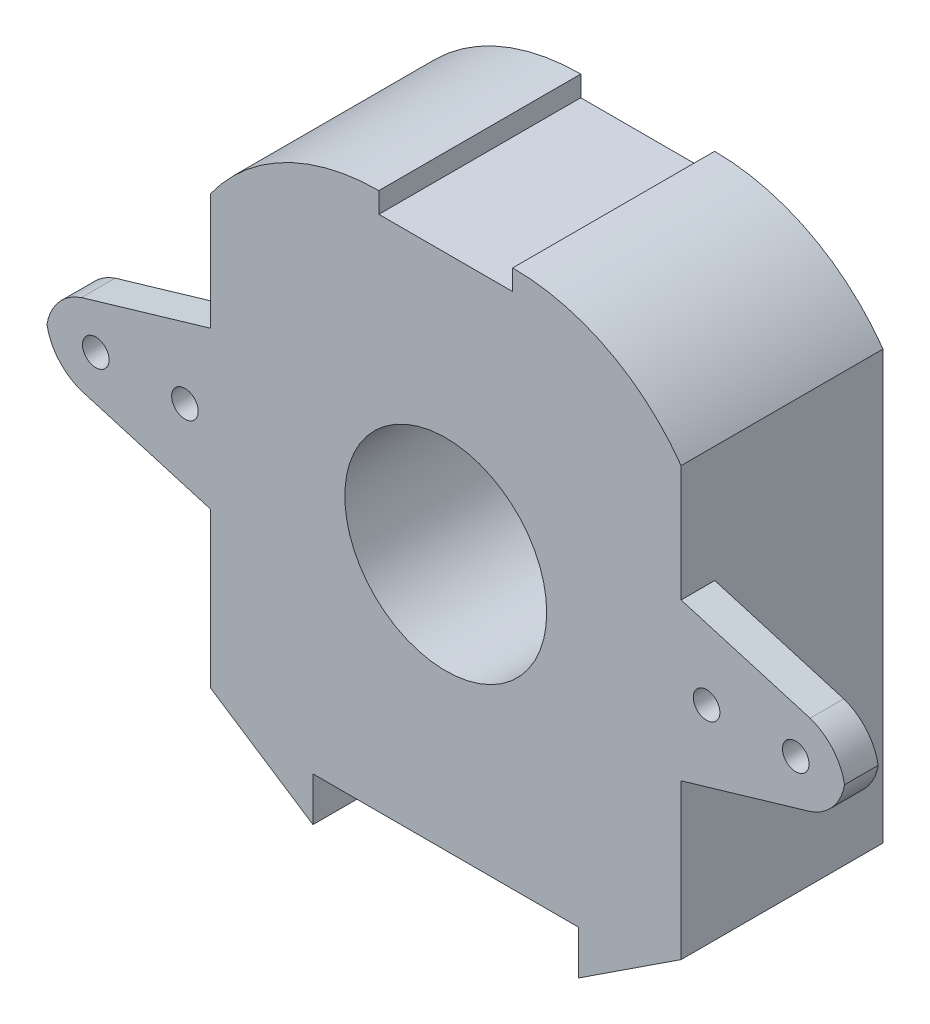
from build123d import *

# Parameters (mm, degrees)
BOSS_EXTRUDE2_DEPTH     = 15.24
SKETCH5_R               = 7.62
CUT_EXTRUDE2_DEPTH      = 15.24
BOSS_EXTRUDE3_DEPTH     = 2.54
CUT_EXTRUDE5_DEPTH      = 41.652633663
CUT_EXTRUDE5_DEPTH_BACK = 41.652633663
SKETCH7_R               = 1.0033


with BuildPart() as part:
    # Sketch1 → Boss-Extrude2 (new body)
    with BuildSketch(Plane.XY):
        with BuildLine():
            Line((-17.763499893, 14.683044609), (-17.763499893, -17.608986031))
            Line((-17.763499893, -17.608986031), (-10.024087591, -22.679635471))
            Line((-10.024087591, -22.679635471), (-10.024087591, -19.359490178))
            Line((-10.024087591, -19.359490178), (10.024087591, -19.359490178))
            Line((10.024087591, -19.359490178), (10.024087591, -22.679635471))
            Line((10.024087591, -22.679635471), (17.763499893, -17.608986031))
            Line((17.763499893, -17.608986031), (17.763499893, 14.683044609))
            ThreePointArc((17.763499893, 14.683044609), (12.2054587, 19.511759091), (5.051122326, 21.250660037))
            Line((5.051122326, 21.250660037), (5.051122326, 19.699745061))
            Line((5.051122326, 19.699745061), (-5.051122326, 19.699745061))
            Line((-5.051122326, 19.699745061), (-5.051122326, 21.250660037))
            ThreePointArc((-5.051122326, 21.250660037), (-12.2054587, 19.511759091), (-17.763499893, 14.683044609))
        make_face()
    extrude(amount=BOSS_EXTRUDE2_DEPTH)

    # Sketch5 → Cut-Extrude2 (cut)
    with BuildSketch(Plane.XY.offset(15.24)):
        Circle(SKETCH5_R)
    extrude(amount=-CUT_EXTRUDE2_DEPTH, mode=Mode.SUBTRACT)

    # Sketch6 → Boss-Extrude3 (add)
    with BuildSketch(Plane.XY.offset(15.24)):
        with BuildLine():
            Line((-27.497120647, 3.03730764), (-17.763499893, 5.900096548))
            Line((-17.763499893, 5.900096548), (-17.763499893, -5.920973667))
            Line((-17.763499893, -5.920973667), (-27.497120647, -3.058184758))
            ThreePointArc((-27.497120647, -3.058184758), (-29.216566103, -1.891287663), (-30.10005247, -0.010438559))
            ThreePointArc((-30.10005247, -0.010438559), (-29.216566103, 1.870410544), (-27.497120647, 3.03730764))
        make_face()
        with BuildLine():
            Line((27.497120647, 3.03730764), (17.763499893, 5.900096548))
            Line((17.763499893, 5.900096548), (17.763499893, -5.920973667))
            Line((17.763499893, -5.920973667), (27.497120647, -3.058184758))
            ThreePointArc((27.497120647, -3.058184758), (29.216566103, -1.891287663), (30.10005247, -0.010438559))
            ThreePointArc((30.10005247, -0.010438559), (29.216566103, 1.870410544), (27.497120647, 3.03730764))
        make_face()
    extrude(amount=-BOSS_EXTRUDE3_DEPTH)

    # Sketch7 → Cut-Extrude5 (cut, two sides: drawn at the far end of the back side and taken through both)
    with BuildSketch(Plane(origin=(0, 0, 0), x_dir=(-1, 0, 0), z_dir=(0, 0, -1)).offset(-CUT_EXTRUDE5_DEPTH_BACK)):
        with Locations(Location((-19.685, 0, 0), (0, 0, 180))):
            Circle(SKETCH7_R)
        with Locations(Location((-26.416, 0, 0), (0, 0, 180))):
            Circle(SKETCH7_R)
        with Locations(Location((19.685, 0, 0), (0, 0, 180))):
            Circle(SKETCH7_R)
        with Locations(Location((26.416, 0, 0), (0, 0, 180))):
            Circle(SKETCH7_R)
    extrude(amount=CUT_EXTRUDE5_DEPTH + CUT_EXTRUDE5_DEPTH_BACK, mode=Mode.SUBTRACT)


solid = part.part
